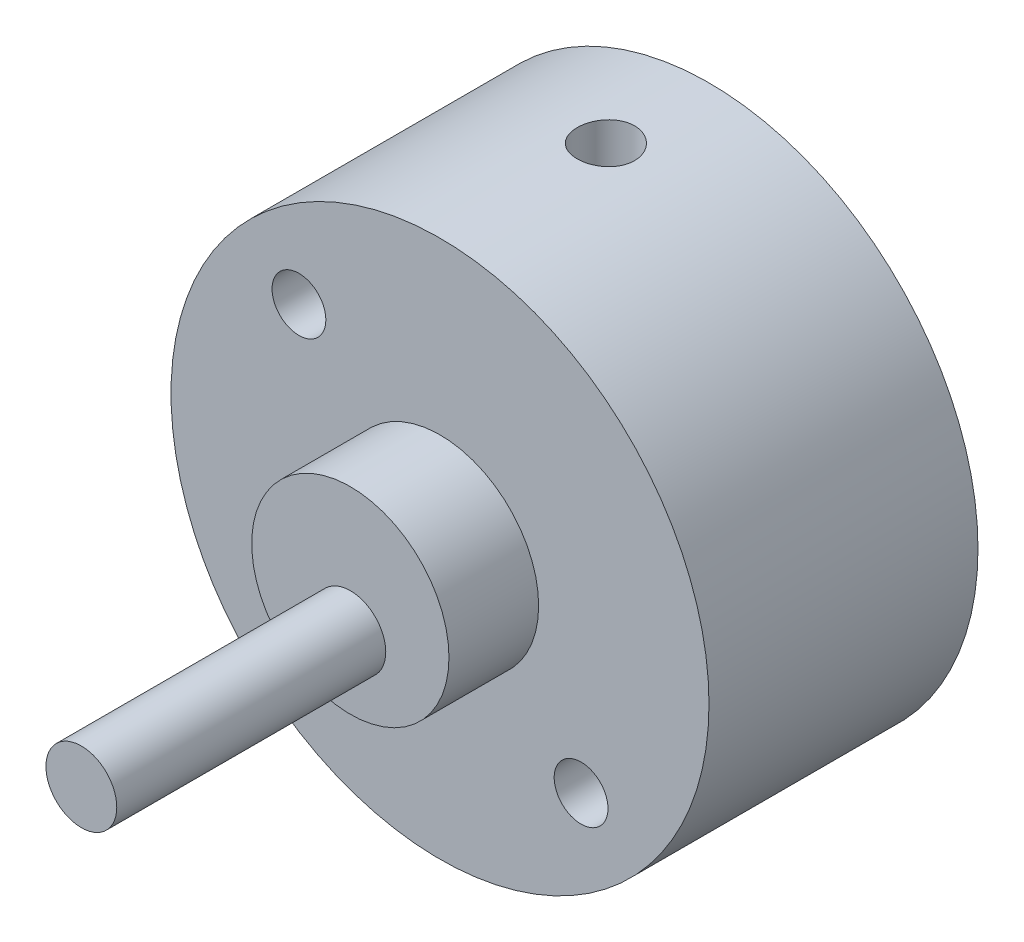
from build123d import *

# Parameters (mm, degrees)
SKETCH1_R             = 30
BOSS_EXTRUDE1_DEPTH   = 30
F_6_0MM_DOWEL_HOLE1_D = 6
SKETCH2_R             = 11
BOSS_EXTRUDE2_DEPTH   = 10
SKETCH9_R             = 3.95
BOSS_EXTRUDE3_DEPTH   = 30
SKETCH10_R            = 10.25
CUT_EXTRUDE2_DEPTH    = 20.5
SKETCH12_R            = 3.2
CUT_EXTRUDE3_DEPTH    = 70


with BuildPart() as part:
    # Sketch1 → Boss-Extrude1 (new body)
    with BuildSketch(Plane.XY):
        Circle(SKETCH1_R)
    extrude(amount=BOSS_EXTRUDE1_DEPTH)

    # Ø6.0mm Dowel Hole1 (through all)
    with Locations(Plane.XY.offset(30)):
        with Locations((-15.733125881, 15.733125881), (15.733125881, -15.733125881), (-15.733125881, -15.733125881)):
            Hole(F_6_0MM_DOWEL_HOLE1_D / 2)

    # Sketch2 → Boss-Extrude2 (add)
    with BuildSketch(Plane.XY.offset(30)):
        Circle(SKETCH2_R)
    extrude(amount=BOSS_EXTRUDE2_DEPTH)

    # Sketch9 → Boss-Extrude3 (add)
    with BuildSketch(Plane.XY.offset(40)):
        with Locations((0, -3)):
            Circle(SKETCH9_R)
    extrude(amount=BOSS_EXTRUDE3_DEPTH)

    # Sketch10 → Cut-Extrude2 (cut)
    with BuildSketch(Plane(origin=(0, 0, 0), x_dir=(-1, 0, 0), z_dir=(0, 0, -1))):
        Circle(SKETCH10_R)
    extrude(amount=-CUT_EXTRUDE2_DEPTH, mode=Mode.SUBTRACT)

    # Sketch12 → Cut-Extrude3 (cut)
    with BuildSketch(Plane(origin=(0, 30, 0), x_dir=(1, 0, 0), z_dir=(0, 1, 0))):
        with Locations(Location((0, -11.5, 0), (0, 0, 270))):
            Circle(SKETCH12_R)
    extrude(amount=-CUT_EXTRUDE3_DEPTH, mode=Mode.SUBTRACT)


solid = part.part
